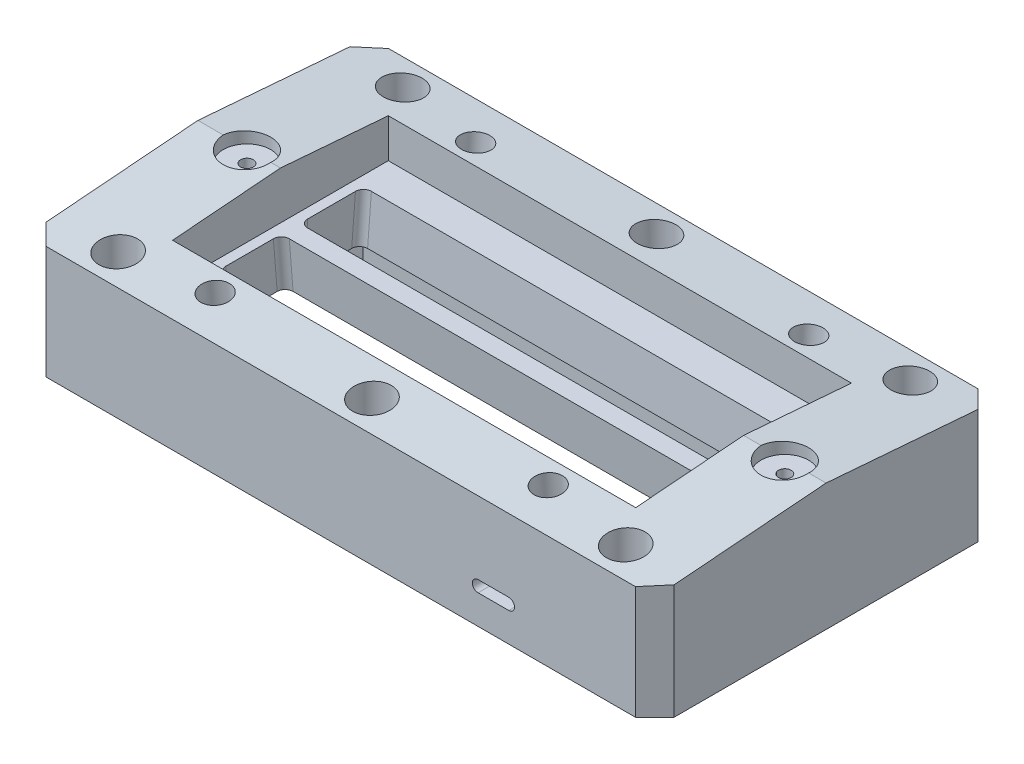
from build123d import *

# Parameters (mm, degrees)
SKETCH1_W             = 198
SKETCH1_H             = 108
BOSS_EXTRUDE1_DEPTH   = 40
SKETCH4_W             = 181
SKETCH4_H             = 45
CUT_EXTRUDE2_DEPTH    = 10
CUT_EXTRUDE3_START    = -198
CUT_EXTRUDE3_DEPTH    = 198
BOSS_EXTRUDE11_DEPTH  = 10
CUT_EXTRUDE12_DEPTH   = 198
CUT_EXTRUDE28_DEPTH   = 14.5
CUT_EXTRUDE29_DEPTH   = 14.5
CUT_EXTRUDE40_REACH   = 231.059
SKETCH12_R            = 3.15
CUT_EXTRUDE9_DEPTH    = 230.058944379
SKETCH13_R            = 4.5
CUT_EXTRUDE10_DEPTH   = 16.5
SKETCH14_R            = 4.5
CUT_EXTRUDE11_DEPTH   = 16.5
SKETCH41_R            = 2.9
CUT_EXTRUDE21_DEPTH   = 7
CUT_EXTRUDE22_DEPTH   = 10
CUT_EXTRUDE23_DEPTH   = 10
CUT_EXTRUDE35_DEPTH   = 55.4
CUT_EXTRUDE34_DEPTH   = 55.4
CUT_EXTRUDE36_DEPTH   = 55.4
SKETCH90_R            = 6.1
CUT_EXTRUDE38_DEPTH   = 17
SKETCH96_R            = 2
CUT_EXTRUDE39_DEPTH   = 230.058944379
SKETCH98_R            = 7.5
CUT_EXTRUDE41_DEPTH   = 4
CROQUIS1_W            = 146
CROQUIS1_H            = 68
CORTAR_EXTRUIR1_DEPTH = 15


with BuildPart() as part:
    # Sketch1 → Boss-Extrude1 (new body)
    with BuildSketch(Plane(origin=(0, 0, 0), x_dir=(1, 0, 0), z_dir=(0, 1, 0))):
        with Locations((99, 54)):
            Rectangle(SKETCH1_W, SKETCH1_H)
    extrude(amount=BOSS_EXTRUDE1_DEPTH)

    # Sketch4 → Cut-Extrude2 (cut)
    with BuildSketch(Plane(origin=(0, 0, 0), x_dir=(1, 0, 0), z_dir=(0, 1, 0))):
        with Locations((99, 54)):
            Rectangle(SKETCH4_W, SKETCH4_H)
    extrude(amount=CUT_EXTRUDE2_DEPTH, mode=Mode.SUBTRACT)

    # Sketch5 → Cut-Extrude3 (cut)
    with BuildSketch(Plane(origin=(198, 0, 0), x_dir=(0, 0, -1), z_dir=(1, 0, 0)).offset(CUT_EXTRUDE3_START)):
        Polygon((54, 40), (108, 35.674234207), (108, 40), align=None)
    extrude(amount=CUT_EXTRUDE3_DEPTH, mode=Mode.SUBTRACT)

    # Sketch53 → Boss-Extrude11 (add)
    with BuildSketch(Plane(origin=(0, 10, 0), x_dir=(-1, 0, 0), z_dir=(0, -1, 0))):
        Polygon((-8.5, 51.5), (-8.5, 31.5), (-39.5, 31.5), align=None)
        Polygon((-8.5, 56.5), (-8.5, 76.5), (-39.5, 76.5), align=None)
        Polygon((-158.5, 76.5), (-189.5, 56.5), (-189.5, 76.5), align=None)
        Polygon((-158.5, 31.5), (-189.5, 51.5), (-189.5, 31.5), align=None)
    extrude(amount=BOSS_EXTRUDE11_DEPTH)

    # Sketch18 → Cut-Extrude12 (cut)
    with BuildSketch(Plane(origin=(198, 0, 0), x_dir=(0, 0, -1), z_dir=(1, 0, 0))):
        Polygon((0, 35.674234207), (0, 40), (54, 40), align=None)
    extrude(amount=-CUT_EXTRUDE12_DEPTH, mode=Mode.SUBTRACT)

    # Izq → Cut-Extrude28 (cut)
    with BuildSketch(Plane(origin=(0, 28.012686094, -12.204810084), x_dir=(1, 0, 0), z_dir=(0, 0.9167660546215652, -0.39942458749256926))):
        Polygon((8.5, 48.862182113), (29.5, 70.132603179), (8.5, 70.132603179), align=None)
    cut_extrude28 = extrude(amount=-CUT_EXTRUDE28_DEPTH, mode=Mode.SUBTRACT)

    # Der → Cut-Extrude29 (cut)
    with BuildSketch(Plane(origin=(0, -11.144923858, -4.62106599), x_dir=(1, 0, 0), z_dir=(0, 0.9237421135716327, 0.38301502270043264))):
        Polygon((8.5, 51.290217599), (29.5, 29.097876578), (8.5, 29.097876578), align=None)
    cut_extrude29 = extrude(amount=-CUT_EXTRUDE29_DEPTH, mode=Mode.SUBTRACT)

    # Cut-Extrude40: up to this face of the body (flat: up to its plane)
    cut_extrude40_end = Plane(part.part.faces().sort_by_distance((99, 10, -54))[0])
    # Sketch97 → Cut-Extrude40 (cut, up to the picked face)
    with BuildSketch(Plane(origin=(0, 0, 0), x_dir=(1, 0, 0), z_dir=(0, 1, 0)), mode=Mode.PRIVATE) as cut_extrude40_sk1:
        Polygon((8.5, 57.5), (29.5, 76.5), (158.5, 76.5), (189.5, 56.5), (189.5, 51.5), (158.5, 31.5), (29.5, 31.5), (8.5, 51.5), align=None)
    cut_extrude40_tool1 = split(extrude(cut_extrude40_sk1.sketch, amount=CUT_EXTRUDE40_REACH, mode=Mode.PRIVATE), bisect_by=cut_extrude40_end, keep=Keep.BOTH, mode=Mode.PRIVATE)
    cut_extrude40 = cut_extrude40_tool1.solids().sort_by(Axis((96.82024, 0, -54.014019), (0, 1, 0)))[0]
    add(cut_extrude40, mode=Mode.SUBTRACT)

    # Mirror2: Cut-Extrude28, Cut-Extrude29, Cut-Extrude40 across plane
    add(cut_extrude28.mirror(Plane(origin=(99, 0, 0), x_dir=(0, 0, 1), z_dir=(1, 0, 0))), mode=Mode.SUBTRACT)
    add(cut_extrude29.mirror(Plane(origin=(99, 0, 0), x_dir=(0, 0, 1), z_dir=(1, 0, 0))), mode=Mode.SUBTRACT)
    add(cut_extrude40.mirror(Plane(origin=(99, 0, 0), x_dir=(0, 0, 1), z_dir=(1, 0, 0))), mode=Mode.SUBTRACT)

    # Sketch12 → Cut-Extrude9 (cut, through all)
    with BuildSketch(Plane(origin=(0, 40, 0), x_dir=(1, 0, 0), z_dir=(0, 1, 0))):
        with Locations(Location((19.7, 98.85, 0), (0, 0, 270))):
            Circle(SKETCH12_R)
        with Locations(Location((99.7, 9.15, 0), (0, 0, 270))):
            Circle(SKETCH12_R)
        with Locations(Location((179.7, 9.15, 0), (0, 0, 270))):
            Circle(SKETCH12_R)
        with Locations(Location((19.7, 9.15, 0), (0, 0, 270))):
            Circle(SKETCH12_R)
        with Locations(Location((99.7, 98.85, 0), (0, 0, 270))):
            Circle(SKETCH12_R)
        with Locations(Location((179.7, 98.85, 0), (0, 0, 270))):
            Circle(SKETCH12_R)
    extrude(amount=-CUT_EXTRUDE9_DEPTH, mode=Mode.SUBTRACT)

    # Sketch13 → Cut-Extrude10 (cut)
    with BuildSketch(Plane(origin=(0, 44.04313679, -3.528153602), x_dir=(1, 0, 0), z_dir=(0, 0.9968068124341598, -0.07985097798305206))):
        with Locations(Location((46.5, 91.806513253, 0), (0, 0, 270))):
            Circle(SKETCH13_R)
        with Locations(Location((151.5, 91.806513253, 0), (0, 0, 270))):
            Circle(SKETCH13_R)
    extrude(amount=-CUT_EXTRUDE10_DEPTH, mode=Mode.SUBTRACT)

    # Sketch14 → Cut-Extrude11 (cut)
    with BuildSketch(Plane(origin=(0, 35.212287021, 5.766643233), x_dir=(1, 0, 0), z_dir=(0, 0.9968068124341597, 0.07985097798305243))):
        with Locations(Location((46.5, 18.739607443, 0), (0, 0, 270))):
            Circle(SKETCH14_R)
        with Locations(Location((151.5, 18.739607443, 0), (0, 0, 270))):
            Circle(SKETCH14_R)
    extrude(amount=-CUT_EXTRUDE11_DEPTH, mode=Mode.SUBTRACT)

    # Sketch41 → Cut-Extrude21 (cut)
    with BuildSketch(Plane(origin=(0, 0, 0), x_dir=(1, 0, 0), z_dir=(0, 1, 0))):
        with Locations(Location((139.5, 9, 0), (0, 0, 90))):
            Circle(SKETCH41_R)
        with Locations(Location((139.5, 99, 0), (0, 0, 90))):
            Circle(SKETCH41_R)
    extrude(amount=CUT_EXTRUDE21_DEPTH, mode=Mode.SUBTRACT)

    # Sketch42 → Cut-Extrude22 (cut)
    with BuildSketch(Plane.XY):
        with BuildLine():
            Line((142.3, 12.8), (152, 12.8))
            ThreePointArc((152, 12.8), (153.8, 11), (152, 9.2))
            Line((152, 9.2), (142.3, 9.2))
            ThreePointArc((142.3, 9.2), (140.5, 11), (142.3, 12.8))
        make_face()
    extrude(amount=-CUT_EXTRUDE22_DEPTH, mode=Mode.SUBTRACT)

    # Sketch43 → Cut-Extrude23 (cut)
    with BuildSketch(Plane(origin=(0, 0, -108), x_dir=(-1, 0, 0), z_dir=(0, 0, -1))):
        with BuildLine():
            Line((-55.7, 12.8), (-46, 12.8))
            ThreePointArc((-46, 12.8), (-44.2, 11), (-46, 9.2))
            Line((-46, 9.2), (-55.7, 9.2))
            ThreePointArc((-55.7, 9.2), (-57.5, 11), (-55.7, 12.8))
        make_face()
    extrude(amount=-CUT_EXTRUDE23_DEPTH, mode=Mode.SUBTRACT)

    # Sketch84 → Cut-Extrude35 (cut)
    with BuildSketch(Plane(origin=(0, 44.04313679, -3.528153602), x_dir=(1, 0, 0), z_dir=(0, 0.9968068124341598, -0.07985097798305206))):
        with BuildLine():
            Line((31.7, 54.733528752), (166.7, 54.733528752))
            ThreePointArc((166.7, 54.733528752), (168.467766953, 55.465761799), (169.2, 57.233528752))
            Line((169.2, 57.233528752), (169.2, 72.233528752))
            ThreePointArc((169.2, 72.233528752), (168.467766953, 74.001295705), (166.7, 74.733528752))
            Line((166.7, 74.733528752), (31.7, 74.733528752))
            ThreePointArc((31.7, 74.733528752), (29.932233047, 74.001295705), (29.2, 72.233528752))
            Line((29.2, 72.233528752), (29.2, 57.233528752))
            ThreePointArc((29.2, 57.233528752), (29.932233047, 55.465761799), (31.7, 54.733528752))
        make_face()
    extrude(amount=-CUT_EXTRUDE35_DEPTH, mode=Mode.SUBTRACT)

    # Sketch83 → Cut-Extrude34 (cut)
    with BuildSketch(Plane(origin=(0, 35.446768916, 2.839526304), x_dir=(1, 0, 0), z_dir=(0, 0.9968068124341598, 0.07985097798305245))):
        with BuildLine():
            Line((31.7, 52.921606991), (166.7, 52.921606991))
            ThreePointArc((166.7, 52.921606991), (168.467766953, 52.189373944), (169.2, 50.421606991))
            Line((169.2, 50.421606991), (169.2, 35.421606991))
            ThreePointArc((169.2, 35.421606991), (168.467766953, 33.653840038), (166.7, 32.921606991))
            Line((166.7, 32.921606991), (31.7, 32.921606991))
            ThreePointArc((31.7, 32.921606991), (29.932233047, 33.653840038), (29.2, 35.421606991))
            Line((29.2, 35.421606991), (29.2, 50.421606991))
            ThreePointArc((29.2, 50.421606991), (29.932233047, 52.189373944), (31.7, 52.921606991))
        make_face()
    extrude(amount=-CUT_EXTRUDE34_DEPTH, mode=Mode.SUBTRACT)

    # Sketch85 → Cut-Extrude36 (cut)
    with BuildSketch(Plane(origin=(0, 40, 0), x_dir=(1, 0, 0), z_dir=(0, 1, 0))):
        Polygon((0, 101.9), (6.1, 108), (0, 108), align=None)
        Polygon((0, 0), (6.1, 0), (0, 6.1), align=None)
        Polygon((198, 6.1), (191.9, 0), (198, 0), align=None)
        Polygon((198, 108), (191.9, 108), (198, 101.9), align=None)
    extrude(amount=-CUT_EXTRUDE36_DEPTH, mode=Mode.SUBTRACT)

    # Sketch90 → Cut-Extrude38 (cut)
    with BuildSketch(Plane(origin=(0, 40, 0), x_dir=(1, 0, 0), z_dir=(0, 1, 0))):
        with Locations(Location((19.7, 9.15, 0), (0, 0, 270))):
            Circle(SKETCH90_R)
        with Locations(Location((99.7, 9.15, 0), (0, 0, 270))):
            Circle(SKETCH90_R)
        with Locations(Location((179.7, 9.15, 0), (0, 0, 270))):
            Circle(SKETCH90_R)
        with Locations(Location((99.7, 98.85, 0), (0, 0, 270))):
            Circle(SKETCH90_R)
        with Locations(Location((179.7, 98.85, 0), (0, 0, 270))):
            Circle(SKETCH90_R)
        with Locations(Location((19.7, 98.85, 0), (0, 0, 270))):
            Circle(SKETCH90_R)
    extrude(amount=-CUT_EXTRUDE38_DEPTH, mode=Mode.SUBTRACT)

    # Sketch96 → Cut-Extrude39 (cut, through all)
    with BuildSketch(Plane(origin=(0, 0, 0), x_dir=(1, 0, 0), z_dir=(0, 1, 0))):
        with Locations(Location((15.45, 54, 0), (0, 0, 180))):
            Circle(SKETCH96_R)
        with Locations((185, 54)):
            Circle(SKETCH96_R)
    extrude(amount=CUT_EXTRUDE39_DEPTH, mode=Mode.SUBTRACT)

    # Sketch98 → Cut-Extrude41 (cut)
    with BuildSketch(Plane(origin=(0, 40, 0), x_dir=(1, 0, 0), z_dir=(0, 1, 0))):
        with Locations(Location((185, 54, 0), (0, 0, 270))):
            Circle(SKETCH98_R)
        with Locations(Location((15.45, 54, 0), (0, 0, 270))):
            Circle(SKETCH98_R)
    extrude(amount=-CUT_EXTRUDE41_DEPTH, mode=Mode.SUBTRACT)

    # Croquis1 → Cortar-Extruir1 (cut)
    with BuildSketch(Plane(origin=(0, 40, 0), x_dir=(1, 0, 0), z_dir=(0, 1, 0))):
        with Locations((99, 54)):
            Rectangle(CROQUIS1_W, CROQUIS1_H)
    extrude(amount=-CORTAR_EXTRUIR1_DEPTH, mode=Mode.SUBTRACT)


solid = part.part
